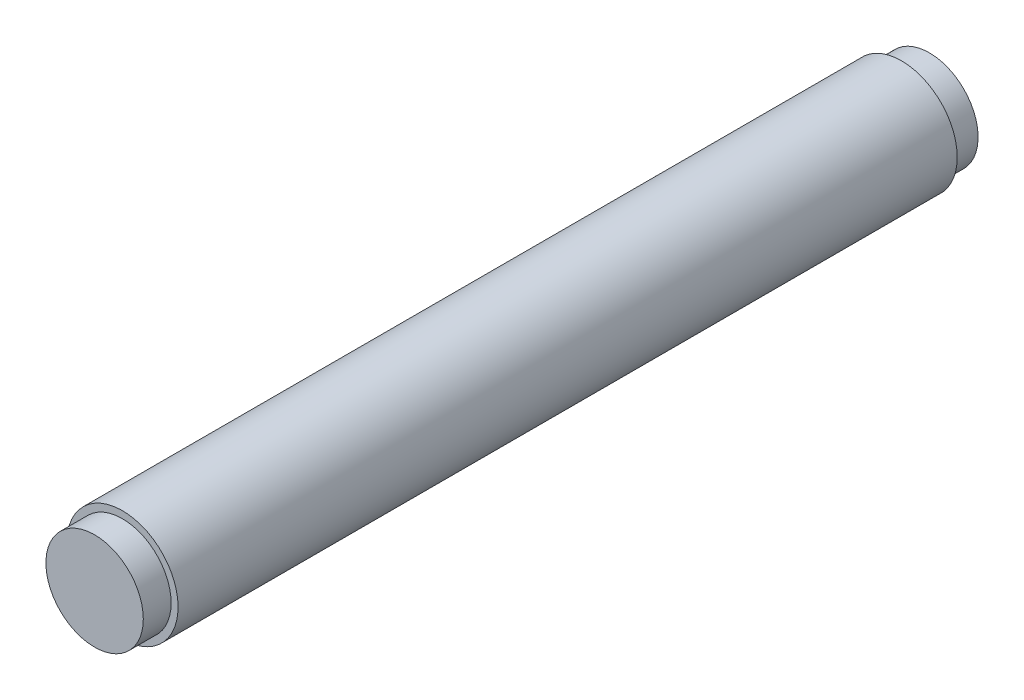
from build123d import *

# Parameters (mm, degrees)
BOSS_EXTRUDE1_START = 190.5
SKETCH1_R           = 25.4
BOSS_EXTRUDE1_DEPTH = 381
SKETCH2_R           = 25.4
SKETCH2_R_2         = 22.225
CUT_EXTRUDE1_DEPTH  = 12.7
CUT_EXTRUDE2_START  = -12.7
SKETCH3_R           = 25.4
SKETCH3_R_2         = 22.225
CUT_EXTRUDE2_DEPTH  = 12.7


with BuildPart() as part:
    # Sketch1 → Boss-Extrude1 (new body)
    with BuildSketch(Plane.XY.offset(BOSS_EXTRUDE1_START)):
        Circle(SKETCH1_R)
    extrude(amount=-BOSS_EXTRUDE1_DEPTH)

    # Sketch2 → Cut-Extrude1 (cut)
    with BuildSketch(Plane.XY.offset(190.5)):
        Circle(SKETCH2_R)
        Circle(SKETCH2_R_2, mode=Mode.SUBTRACT)
    extrude(amount=-CUT_EXTRUDE1_DEPTH, mode=Mode.SUBTRACT)

    # Sketch3 → Cut-Extrude2 (cut)
    with BuildSketch(Plane(origin=(0, 0, -190.5), x_dir=(-1, 0, 0), z_dir=(0, 0, -1)).offset(CUT_EXTRUDE2_START)):
        with Locations(Location((0, 0, 0), (0, 0, 180))):
            Circle(SKETCH3_R)
        with Locations(Location((0, 0, 0), (0, 0, 180))):
            Circle(SKETCH3_R_2, mode=Mode.SUBTRACT)
    extrude(amount=CUT_EXTRUDE2_DEPTH, mode=Mode.SUBTRACT)


solid = part.part
